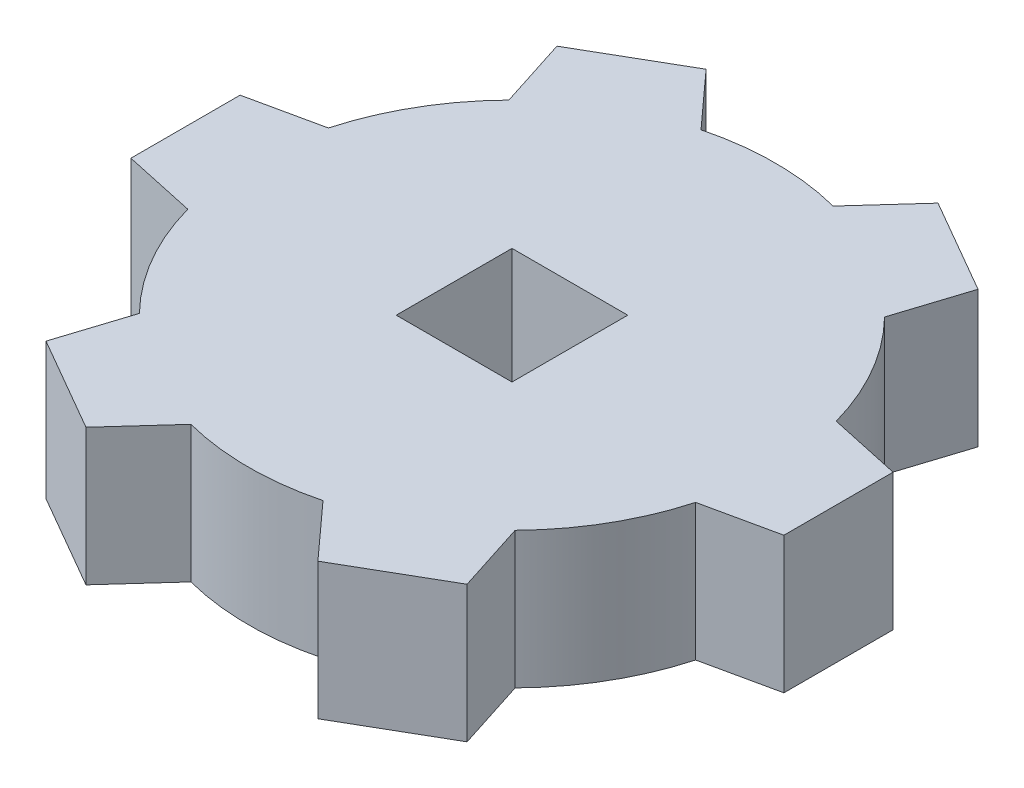
from build123d import *

# Parameters (mm, degrees)
SKETCH2_W           = 4.24
SKETCH2_H           = 4.24
BOSS_EXTRUDE1_DEPTH = 5


with BuildPart() as part:
    # Sketch2 → Boss-Extrude1 (new body)
    with BuildSketch(Plane(origin=(0, 0, 0), x_dir=(1, 0, 0), z_dir=(0, 1, 0))):
        with BuildLine():
            Line((7.711630813, -9.356936378), (4.247529198, -11.356936378))
            Line((4.247529198, -11.356936378), (2.659936491, -9.607145147))
            Line((2.659936491, -9.607145147), (2.419219348, -9.341834817))
            ThreePointArc((2.419219348, -9.341834817), (0, -9.65), (-2.419219348, -9.341834817))
            Line((-2.419219348, -9.341834817), (-2.659936491, -9.607145147))
            Line((-2.659936491, -9.607145147), (-4.247529198, -11.356936378))
            Line((-4.247529198, -11.356936378), (-7.711630813, -9.356936378))
            Line((-7.711630813, -9.356936378), (-6.990063509, -7.107145147))
            Line((-6.990063509, -7.107145147), (-6.880656595, -6.766022821))
            ThreePointArc((-6.880656595, -6.766022821), (-8.357145147, -4.825), (-9.299875943, -2.575811995))
            Line((-9.299875943, -2.575811995), (-9.65, -2.5))
            Line((-9.65, -2.5), (-11.959160012, -2))
            Line((-11.959160012, -2), (-11.959160012, 2))
            Line((-11.959160012, 2), (-9.65, 2.5))
            Line((-9.65, 2.5), (-9.299875943, 2.575811995))
            ThreePointArc((-9.299875943, 2.575811995), (-8.357145147, 4.825), (-6.880656595, 6.766022821))
            Line((-6.880656595, 6.766022821), (-6.990063509, 7.107145147))
            Line((-6.990063509, 7.107145147), (-7.711630813, 9.356936378))
            Line((-7.711630813, 9.356936378), (-4.247529198, 11.356936378))
            Line((-4.247529198, 11.356936378), (-2.659936491, 9.607145147))
            Line((-2.659936491, 9.607145147), (-2.419219348, 9.341834817))
            ThreePointArc((-2.419219348, 9.341834817), (0, 9.65), (2.419219348, 9.341834817))
            Line((2.419219348, 9.341834817), (2.659936491, 9.607145147))
            Line((2.659936491, 9.607145147), (4.247529198, 11.356936378))
            Line((4.247529198, 11.356936378), (7.711630813, 9.356936378))
            Line((7.711630813, 9.356936378), (6.990063509, 7.107145147))
            Line((6.990063509, 7.107145147), (6.880656595, 6.766022821))
            ThreePointArc((6.880656595, 6.766022821), (8.357145147, 4.825), (9.299875943, 2.575811995))
            Line((9.299875943, 2.575811995), (9.65, 2.5))
            Line((9.65, 2.5), (11.959160012, 2))
            Line((11.959160012, 2), (11.959160012, -2))
            Line((11.959160012, -2), (9.65, -2.5))
            Line((9.65, -2.5), (9.299875943, -2.575811995))
            ThreePointArc((9.299875943, -2.575811995), (8.357145147, -4.825), (6.880656595, -6.766022821))
            Line((6.880656595, -6.766022821), (6.990063509, -7.107145147))
            Line((6.990063509, -7.107145147), (7.711630813, -9.356936378))
        make_face()
        Rectangle(SKETCH2_W, SKETCH2_H, mode=Mode.SUBTRACT)
    extrude(amount=BOSS_EXTRUDE1_DEPTH)


solid = part.part
